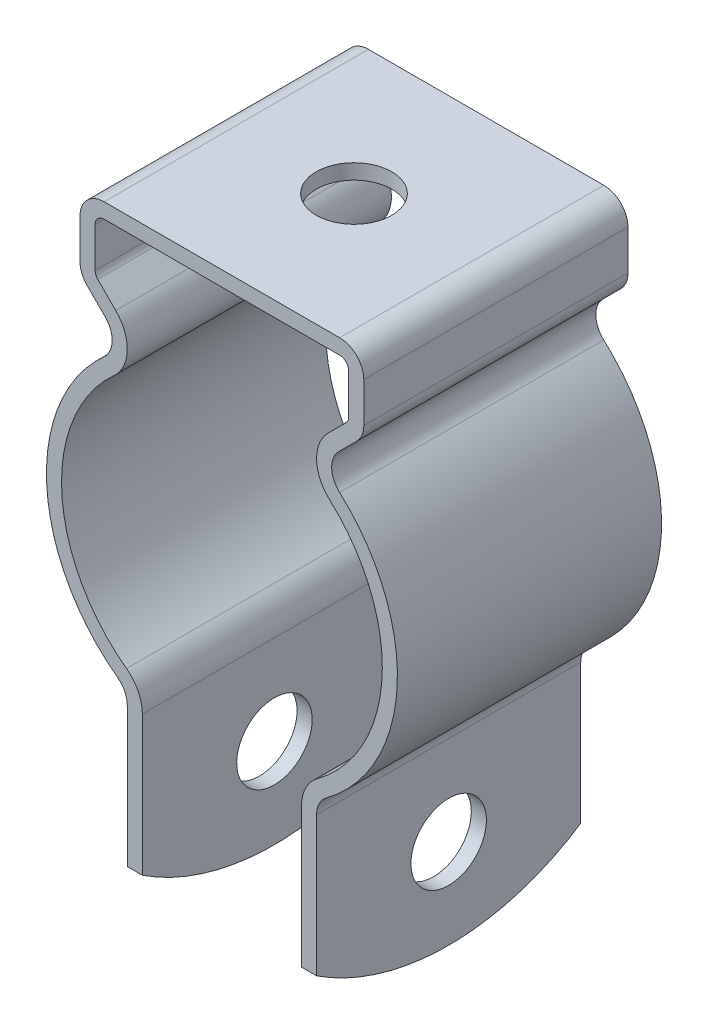
from build123d import *

# Parameters (mm, degrees)
BOSS_EXTRUDE1_DEPTH      = 11.1125
BOSS_EXTRUDE1_DEPTH_BACK = 11.1125
SKETCH4_R                = 3.175
CUT_EXTRUDE1_DEPTH       = 22.225
CUT_EXTRUDE2_DEPTH       = 35.029202096
CUT_EXTRUDE2_DEPTH_BACK  = 35.029202096
CUT_EXTRUDE3_DEPTH       = 35.029202096
CUT_EXTRUDE3_DEPTH_BACK  = 35.029202096
SKETCH6_R                = 3.175


with BuildPart() as part:
    # Sketch3 → Boss-Extrude1 (new, two sides: drawn at the far end of the back side and taken through both)
    with BuildSketch(Plane.XY.offset(-BOSS_EXTRUDE1_DEPTH_BACK)):
        with BuildLine():
            Line((-10.668, 16.843375), (-10.668, 20.193))
            ThreePointArc((-10.668, 20.193), (-10.444815367, 20.731815367), (-9.906, 20.955))
            Line((-9.906, 20.955), (9.906, 20.955))
            ThreePointArc((9.906, 20.955), (10.444815367, 20.731815367), (10.668, 20.193))
            Line((10.668, 20.193), (10.668, 16.843375))
            ThreePointArc((10.668, 16.843375), (10.609996204, 16.551770225), (10.444815367, 16.304559633))
            Line((10.444815367, 16.304559633), (8.931602372, 14.791346638))
            ThreePointArc((8.931602372, 14.791346638), (7.965505779, 12.373739179), (9.051510982, 10.007569035))
            ThreePointArc((9.051510982, 10.007569035), (13.477623457, -0.659511197), (8.031189621, -10.84349032))
            ThreePointArc((8.031189621, -10.84349032), (7.047523696, -12.011383636), (6.694468964, -13.496956187))
            Line((6.694468964, -13.496956187), (6.694468964, -28.575))
            Line((6.694468964, -28.575), (7.964468964, -28.575))
            Line((7.964468964, -28.575), (7.964468964, -13.496956187))
            ThreePointArc((7.964468964, -13.496956187), (8.181733414, -12.582757694), (8.787066292, -11.864054115))
            ThreePointArc((8.787066292, -11.864054115), (14.746105665, -0.721582839), (9.903417898, 10.949457886))
            ThreePointArc((9.903417898, 10.949457886), (9.235107004, 12.40556259), (9.829627985, 13.893321026))
            Line((9.829627985, 13.893321026), (11.342840979, 15.406534021))
            ThreePointArc((11.342840979, 15.406534021), (11.78332321, 16.065762265), (11.938, 16.843375))
            Line((11.938, 16.843375), (11.938, 20.193))
            ThreePointArc((11.938, 20.193), (11.342840979, 21.629840979), (9.906, 22.225))
            Line((9.906, 22.225), (-9.906, 22.225))
            ThreePointArc((-9.906, 22.225), (-11.342840979, 21.629840979), (-11.938, 20.193))
            Line((-11.938, 20.193), (-11.938, 16.843375))
            ThreePointArc((-11.938, 16.843375), (-11.78332321, 16.065762265), (-11.342840979, 15.406534021))
            Line((-11.342840979, 15.406534021), (-9.829627985, 13.893321026))
            ThreePointArc((-9.829627985, 13.893321026), (-9.235107004, 12.40556259), (-9.903417898, 10.949457886))
            ThreePointArc((-9.903417898, 10.949457886), (-14.746105665, -0.721582839), (-8.787066292, -11.864054115))
            ThreePointArc((-8.787066292, -11.864054115), (-8.181733414, -12.582757694), (-7.964468964, -13.496956187))
            Line((-7.964468964, -13.496956187), (-7.964468964, -28.575))
            Line((-7.964468964, -28.575), (-6.694468964, -28.575))
            Line((-6.694468964, -28.575), (-6.694468964, -13.496956187))
            ThreePointArc((-6.694468964, -13.496956187), (-7.047523696, -12.011383636), (-8.031189621, -10.84349032))
            ThreePointArc((-8.031189621, -10.84349032), (-13.477623457, -0.659511197), (-9.051510982, 10.007569035))
            ThreePointArc((-9.051510982, 10.007569035), (-7.965505779, 12.373739179), (-8.931602372, 14.791346638))
            Line((-8.931602372, 14.791346638), (-10.444815367, 16.304559633))
            ThreePointArc((-10.444815367, 16.304559633), (-10.609996204, 16.551770225), (-10.668, 16.843375))
        make_face()
    extrude(amount=BOSS_EXTRUDE1_DEPTH + BOSS_EXTRUDE1_DEPTH_BACK)

    # Sketch4 → Cut-Extrude1 (cut)
    with BuildSketch(Plane(origin=(0, 22.225, 0), x_dir=(1, 0, 0), z_dir=(0, 1, 0))):
        with Locations(Location((0, 0, 0), (0, 0, 270))):
            Circle(SKETCH4_R)
    extrude(amount=-CUT_EXTRUDE1_DEPTH, mode=Mode.SUBTRACT)

    # Sketch5 → Cut-Extrude2 (cut, two sides: drawn at the far end of the back side and taken through both)
    with BuildSketch(Plane(origin=(0, 0, 0), x_dir=(0, 0, -1), z_dir=(1, 0, 0)).offset(-CUT_EXTRUDE2_DEPTH_BACK)):
        with BuildLine():
            Line((-11.1125, -25.24125), (-11.1125, -31.90875))
            Line((-11.1125, -31.90875), (11.1125, -31.90875))
            Line((11.1125, -31.90875), (11.1125, -25.24125))
            ThreePointArc((11.1125, -25.24125), (0, -28.575), (-11.1125, -25.24125))
        make_face()
    extrude(amount=CUT_EXTRUDE2_DEPTH + CUT_EXTRUDE2_DEPTH_BACK, mode=Mode.SUBTRACT)

    # Sketch6 → Cut-Extrude3 (cut, two sides: drawn at the far end of the back side and taken through both)
    with BuildSketch(Plane(origin=(0, 0, 0), x_dir=(0, 0, -1), z_dir=(1, 0, 0)).offset(-CUT_EXTRUDE3_DEPTH_BACK)):
        with Locations(Location((0, -21.035978094, 0), (0, 0, 270))):
            Circle(SKETCH6_R)
    extrude(amount=CUT_EXTRUDE3_DEPTH + CUT_EXTRUDE3_DEPTH_BACK, mode=Mode.SUBTRACT)


solid = part.part
